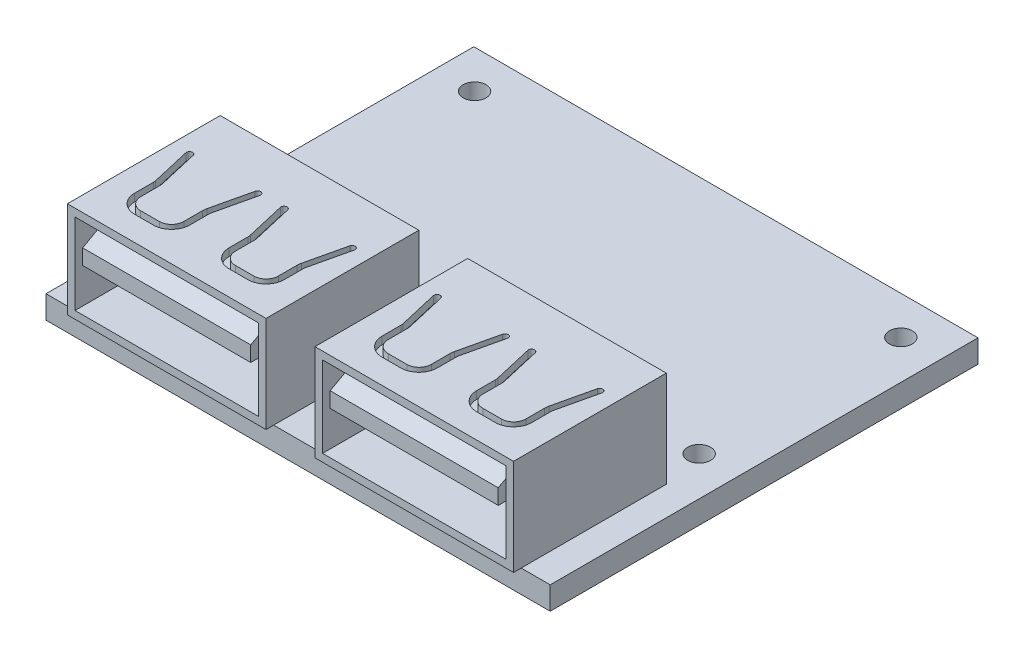
from build123d import *

# Parameters (mm, degrees)
SKETCH1_W                 = 33
SKETCH1_H                 = 28
SKETCH1_R                 = 0.75
BOSS_EXTRUDE1_DEPTH       = 1.5
SKETCH2_W                 = 13
SKETCH2_H                 = 10
BOSS_EXTRUDE2_DEPTH       = 6.3
SKETCH3_W                 = 12
SKETCH3_H                 = 5.3
CUT_EXTRUDE1_DEPTH        = 9.5
CUT_EXTRUDE2_REACH        = 25.31
SKETCH5_W                 = 11
SKETCH5_H                 = 2
BOSS_EXTRUDE3_DEPTH       = 9.5
CHAMFER1_SIZE             = 1
CHAMFER1_SIZE2            = 1.804047755
CHAMFER1_OF_MIRROR4_SIZE2 = 1
CHAMFER1_OF_MIRROR4_SIZE  = 1.804047755


with BuildPart() as part:
    # Sketch1 → Boss-Extrude1 (new body)
    with BuildSketch(Plane(origin=(0, 0, 0), x_dir=(1, 0, 0), z_dir=(0, 1, 0))):
        Rectangle(SKETCH1_W, SKETCH1_H)
        with Locations(Location((-13.95, 11.5, 0), (0, 0, 270))):
            Circle(SKETCH1_R, mode=Mode.SUBTRACT)
        with Locations(Location((13.95, 11.5, 0), (0, 0, 270))):
            Circle(SKETCH1_R, mode=Mode.SUBTRACT)
        with Locations(Location((13.95, -1.7, 0), (0, 0, 270))):
            Circle(SKETCH1_R, mode=Mode.SUBTRACT)
        with Locations(Location((-13.95, -1.7, 0), (0, 0, 270))):
            Circle(SKETCH1_R, mode=Mode.SUBTRACT)
    extrude(amount=BOSS_EXTRUDE1_DEPTH)

    # Sketch2 → Boss-Extrude2 (add)
    with BuildSketch(Plane(origin=(0, 1.5, 0), x_dir=(1, 0, 0), z_dir=(0, 1, 0))):
        with Locations((-8.1, -9.5)):
            Rectangle(SKETCH2_W, SKETCH2_H)
    boss_extrude2 = extrude(amount=BOSS_EXTRUDE2_DEPTH)

    # Sketch3 → Cut-Extrude1 (cut)
    with BuildSketch(Plane.XY.offset(14.5)):
        with Locations((-8.1, 4.65)):
            Rectangle(SKETCH3_W, SKETCH3_H)
    cut_extrude1 = extrude(amount=-CUT_EXTRUDE1_DEPTH, mode=Mode.SUBTRACT)

    # Sketch4 → Cut-Extrude2 (cut, up to next)
    with BuildSketch(Plane(origin=(0, 7.8, 0), x_dir=(1, 0, 0), z_dir=(0, 1, 0)), mode=Mode.PRIVATE) as cut_extrude2_sk1:
        with BuildLine():
            Line((-13.614934874, -7.733680754), (-13.022262005, -10.296990911))
            ThreePointArc((-13.022262005, -10.296990911), (-13.006856344, -10.386514555), (-13.001698958, -10.477207547))
            Line((-13.001698958, -10.477207547), (-13.001698958, -11.69747768))
            ThreePointArc((-13.001698958, -11.69747768), (-12.650227096, -12.546005817), (-11.801698958, -12.89747768))
            Line((-11.801698958, -12.89747768), (-10.586140238, -12.89747768))
            ThreePointArc((-10.586140238, -12.89747768), (-9.7376121, -12.546005817), (-9.386140238, -11.69747768))
            Line((-9.386140238, -11.69747768), (-9.386140238, -10.477207547))
            ThreePointArc((-9.386140238, -10.477207547), (-9.380982852, -10.386514555), (-9.365577191, -10.296990911))
            Line((-9.365577191, -10.296990911), (-8.772904322, -7.733680754))
            ThreePointArc((-8.772904322, -7.733680754), (-8.922709401, -7.493767357), (-9.162622799, -7.643572436))
            Line((-9.162622799, -7.643572436), (-9.755295667, -10.206882592))
            ThreePointArc((-9.755295667, -10.206882592), (-9.778404159, -10.34116806), (-9.786140238, -10.477207547))
            Line((-9.786140238, -10.477207547), (-9.786140238, -11.69747768))
            ThreePointArc((-9.786140238, -11.69747768), (-10.020454813, -12.263163104), (-10.586140238, -12.49747768))
            Line((-10.586140238, -12.49747768), (-11.801698958, -12.49747768))
            ThreePointArc((-11.801698958, -12.49747768), (-12.367384383, -12.263163104), (-12.601698958, -11.69747768))
            Line((-12.601698958, -11.69747768), (-12.601698958, -10.477207547))
            ThreePointArc((-12.601698958, -10.477207547), (-12.609435037, -10.34116806), (-12.632543529, -10.206882592))
            Line((-12.632543529, -10.206882592), (-13.225216397, -7.643572436))
            ThreePointArc((-13.225216397, -7.643572436), (-13.465129794, -7.493767357), (-13.614934874, -7.733680754))
        make_face()
    cut_extrude2_tool1 = extrude(cut_extrude2_sk1.sketch, amount=-CUT_EXTRUDE2_REACH, mode=Mode.PRIVATE) & part.part
    # Sketch4 → Cut-Extrude2 (cut, up to next)
    with BuildSketch(Plane(origin=(0, 7.8, 0), x_dir=(1, 0, 0), z_dir=(0, 1, 0)), mode=Mode.PRIVATE) as cut_extrude2_sk2:
        with BuildLine():
            Line((-7.037377201, -7.643572436), (-6.444704333, -10.206882592))
            ThreePointArc((-6.444704333, -10.206882592), (-6.421595841, -10.34116806), (-6.413859762, -10.477207547))
            Line((-6.413859762, -10.477207547), (-6.413859762, -11.69747768))
            ThreePointArc((-6.413859762, -11.69747768), (-6.179545187, -12.263163104), (-5.613859762, -12.49747768))
            Line((-5.613859762, -12.49747768), (-4.398301042, -12.49747768))
            ThreePointArc((-4.398301042, -12.49747768), (-3.832615617, -12.263163104), (-3.598301042, -11.69747768))
            Line((-3.598301042, -11.69747768), (-3.598301042, -10.477207547))
            ThreePointArc((-3.598301042, -10.477207547), (-3.590564963, -10.34116806), (-3.567456471, -10.206882592))
            Line((-3.567456471, -10.206882592), (-2.974783603, -7.643572436))
            ThreePointArc((-2.974783603, -7.643572436), (-2.734870206, -7.493767357), (-2.585065126, -7.733680754))
            Line((-2.585065126, -7.733680754), (-3.177737995, -10.296990911))
            ThreePointArc((-3.177737995, -10.296990911), (-3.193143656, -10.386514555), (-3.198301042, -10.477207547))
            Line((-3.198301042, -10.477207547), (-3.198301042, -11.69747768))
            ThreePointArc((-3.198301042, -11.69747768), (-3.549772904, -12.546005817), (-4.398301042, -12.89747768))
            Line((-4.398301042, -12.89747768), (-5.613859762, -12.89747768))
            ThreePointArc((-5.613859762, -12.89747768), (-6.4623879, -12.546005817), (-6.813859762, -11.69747768))
            Line((-6.813859762, -11.69747768), (-6.813859762, -10.477207547))
            ThreePointArc((-6.813859762, -10.477207547), (-6.819017148, -10.386514555), (-6.834422809, -10.296990911))
            Line((-6.834422809, -10.296990911), (-7.427095678, -7.733680754))
            ThreePointArc((-7.427095678, -7.733680754), (-7.277290599, -7.493767357), (-7.037377201, -7.643572436))
        make_face()
    cut_extrude2_tool2 = extrude(cut_extrude2_sk2.sketch, amount=-CUT_EXTRUDE2_REACH, mode=Mode.PRIVATE) & part.part
    cut_extrude2_1 = cut_extrude2_tool1.solids().sort_by_distance((-13.247802, 7.8, 8.998967))[0]
    add(cut_extrude2_1, mode=Mode.SUBTRACT)
    cut_extrude2_2 = cut_extrude2_tool2.solids().sort_by_distance((-6.741196, 7.8, 11.087343))[0]
    add(cut_extrude2_2, mode=Mode.SUBTRACT)
    cut_extrude2 = cut_extrude2_1 + cut_extrude2_2  # Cut-Extrude2 as one shape, for the pattern or mirror that repeats it

    # Sketch5 → Boss-Extrude3 (add)
    with BuildSketch(Plane.XY.offset(5)):
        with Locations((-8.1, 5.8)):
            Rectangle(SKETCH5_W, SKETCH5_H)
    boss_extrude3 = extrude(amount=BOSS_EXTRUDE3_DEPTH)

    # Chamfer1
    chamfer1_edges = [part.edges().sort_by_distance(p)[0] for p in [
        (-8.1, 6.8, 14.5),
    ]]
    chamfer1_side = [part.faces().sort_by_distance(p)[0] for p in [
        (-8.1, 5.8, 14.5),
    ]]
    chamfer(chamfer1_edges, length=CHAMFER1_SIZE, length2=CHAMFER1_SIZE2, reference=chamfer1_side[0])

    # Mirror4: Boss-Extrude2, Cut-Extrude1, Cut-Extrude2, Boss-Extrude3 across plane
    add(boss_extrude2.mirror(Plane(origin=(0, 0, 0), x_dir=(0, 0, 1), z_dir=(1, 0, 0))))
    add(cut_extrude1.mirror(Plane(origin=(0, 0, 0), x_dir=(0, 0, 1), z_dir=(1, 0, 0))), mode=Mode.SUBTRACT)
    add(cut_extrude2.mirror(Plane(origin=(0, 0, 0), x_dir=(0, 0, 1), z_dir=(1, 0, 0))), mode=Mode.SUBTRACT)
    add(boss_extrude3.mirror(Plane(origin=(0, 0, 0), x_dir=(0, 0, 1), z_dir=(1, 0, 0))))

    # Chamfer1 of Mirror4
    chamfer1_of_mirror4_edges = [part.edges().sort_by_distance(p)[0] for p in [
        (8.1, 6.8, 14.5),
    ]]
    chamfer(chamfer1_of_mirror4_edges, length=CHAMFER1_OF_MIRROR4_SIZE, length2=CHAMFER1_OF_MIRROR4_SIZE2)


solid = part.part
